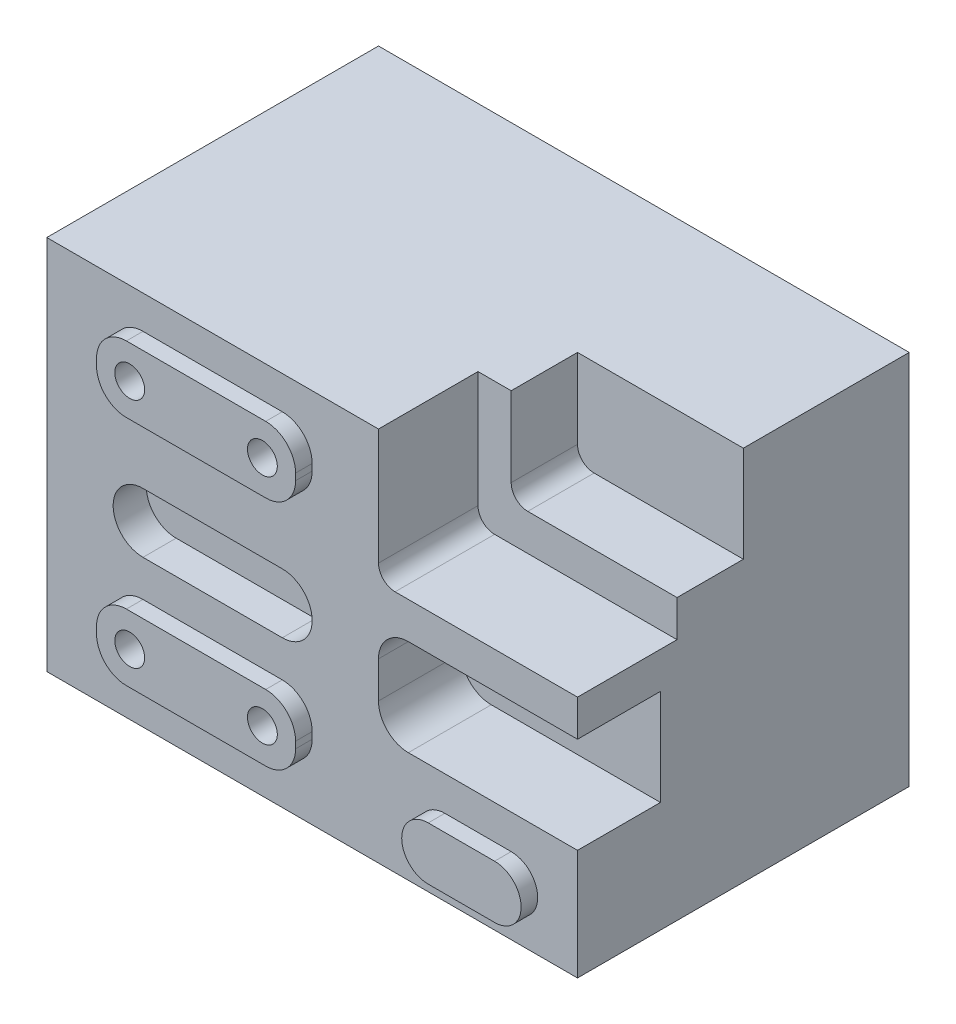
from build123d import *

# Parameters (mm, degrees)
SKETCH1_W           = 160
SKETCH1_H           = 113.333333333
BASE_EXTRUDE_DEPTH  = 100
BOSS_EXTRUDE1_DEPTH = 5
CUT_EXTRUDE1_DEPTH  = 10
CUT_EXTRUDE2_DEPTH  = 30
CUT_EXTRUDE3_DEPTH  = 20
SKETCH7_R           = 4.5
CUT_EXTRUDE4_DEPTH  = 146
CUT_EXTRUDE5_DEPTH  = 25


with BuildPart() as part:
    # Sketch1 → Base-Extrude (new body)
    with BuildSketch(Plane.XY):
        with Locations((0, 3.333333334)):
            Rectangle(SKETCH1_W, SKETCH1_H)
    extrude(amount=-BASE_EXTRUDE_DEPTH)

    # Sketch2 → Boss-Extrude1 (add)
    with BuildSketch(Plane.XY):
        with BuildLine():
            Line((-51, -20), (-9, -20))
            ThreePointArc((-9, -20), (-2.636038969, -22.636038969), (0, -29))
            Line((0, -29), (0, -31))
            ThreePointArc((0, -31), (-2.636038969, -37.363961031), (-9, -40))
            Line((-9, -40), (-51, -40))
            ThreePointArc((-51, -40), (-57.363961031, -37.363961031), (-60, -31))
            Line((-60, -31), (-60, -29))
            ThreePointArc((-60, -29), (-57.363961031, -22.636038969), (-51, -20))
        make_face()
        with BuildLine():
            Line((-51, 50), (-9, 50))
            ThreePointArc((-9, 50), (-2.636038969, 47.363961031), (0, 41))
            Line((0, 41), (0, 39))
            ThreePointArc((0, 39), (-2.636038969, 32.636038969), (-9, 30))
            Line((-9, 30), (-51, 30))
            ThreePointArc((-51, 30), (-57.363961031, 32.636038969), (-60, 39))
            Line((-60, 39), (-60, 41))
            ThreePointArc((-60, 41), (-57.363961031, 47.363961031), (-51, 50))
        make_face()
        with BuildLine():
            Line((60, -30.333333333), (40, -30.333333333))
            ThreePointArc((40, -30.333333333), (32, -38.333333333), (40, -46.333333333))
            Line((40, -46.333333333), (60, -46.333333333))
            ThreePointArc((60, -46.333333333), (68, -38.333333333), (60, -30.333333333))
        make_face()
    extrude(amount=BOSS_EXTRUDE1_DEPTH)

    # Sketch3 → Cut-Extrude1 (cut)
    with BuildSketch(Plane.XY):
        with BuildLine():
            Line((-9, 9), (-51, 9))
            ThreePointArc((-51, 9), (-60, 0), (-51, -9))
            Line((-51, -9), (-9, -9))
            ThreePointArc((-9, -9), (0, 0), (-9, 9))
        make_face()
    extrude(amount=-CUT_EXTRUDE1_DEPTH, mode=Mode.SUBTRACT)

    # Sketch4 → Cut-Extrude2 (cut)
    with BuildSketch(Plane.XY):
        with BuildLine():
            Line((20, 80), (93.333333333, 80))
            Line((93.333333333, 80), (93.333333333, 20))
            Line((93.333333333, 20), (25, 20))
            ThreePointArc((25, 20), (21.464466094, 21.464466094), (20, 25))
            Line((20, 25), (20, 80))
        make_face()
    extrude(amount=-CUT_EXTRUDE2_DEPTH, mode=Mode.SUBTRACT)

    # Sketch5 → Cut-Extrude3 (cut)
    with BuildSketch(Plane.XY.offset(-30)):
        with BuildLine():
            Line((30, 70), (98.390848549, 70))
            Line((98.390848549, 70), (98.390848549, 31))
            Line((98.390848549, 31), (35, 31))
            ThreePointArc((35, 31), (31.464466094, 32.464466094), (30, 36))
            Line((30, 36), (30, 70))
        make_face()
    extrude(amount=-CUT_EXTRUDE3_DEPTH, mode=Mode.SUBTRACT)

    # Sketch7 → Cut-Extrude4 (cut, through all)
    with BuildSketch(Plane.XY.offset(5)):
        with Locations((-50, -30)):
            Circle(SKETCH7_R)
        with Locations((-10, -30)):
            Circle(SKETCH7_R)
        with Locations((-50, 40)):
            Circle(SKETCH7_R)
        with Locations((-10, 40)):
            Circle(SKETCH7_R)
    extrude(amount=-CUT_EXTRUDE4_DEPTH, mode=Mode.SUBTRACT)

    # Sketch9 → Cut-Extrude5 (cut)
    with BuildSketch(Plane.XY):
        with BuildLine():
            Line((29, 9), (103.333333333, 9))
            Line((103.333333333, 9), (103.333333333, -20))
            Line((103.333333333, -20), (29, -20))
            ThreePointArc((29, -20), (22.636038969, -17.363961031), (20, -11))
            Line((20, -11), (20, 0))
            ThreePointArc((20, 0), (22.636038969, 6.363961031), (29, 9))
        make_face()
    extrude(amount=-CUT_EXTRUDE5_DEPTH, mode=Mode.SUBTRACT)


solid = part.part
